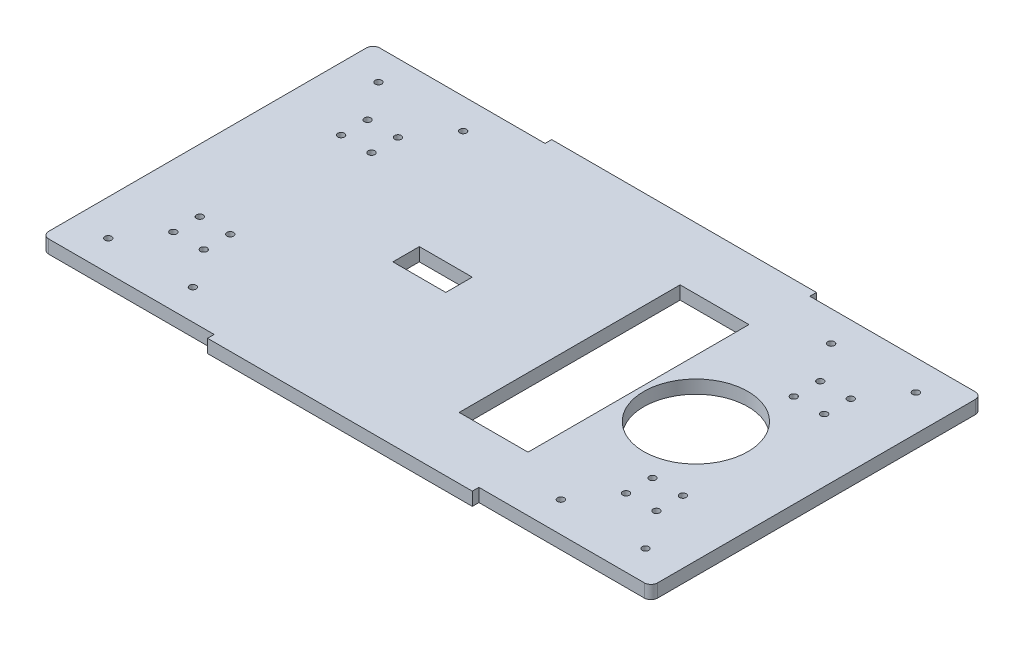
from build123d import *

# Parameters (mm, degrees)
BOSS_EXTRUDE1_DEPTH     = 6.35
SKETCH2_W               = 25.4
SKETCH2_H               = 12.7
CUT_EXTRUDE1_DEPTH      = 186.567817792
SKETCH6_W               = 203.2
SKETCH6_H               = 34.925
CUT_EXTRUDE3_DEPTH      = 186.567817792
SKETCH9_W               = 127
SKETCH9_H               = 3.175
BOSS_EXTRUDE3_DEPTH     = 6.35
SKETCH12_R              = 1.5875
CUT_EXTRUDE5_DEPTH      = 168.885161643
MIRROR2_COPY_1_SKETCH_R = 1.5875
MIRROR2_COPY_1_DEPTH    = 168.885161643
SKETCH13_R              = 25
CUT_EXTRUDE6_DEPTH      = 168.885161643
SKETCH15_W              = 33.02
SKETCH15_H              = 106
CUT_EXTRUDE7_DEPTH      = 168.885161643


with BuildPart() as part:
    # Sketch1 → Boss-Extrude1 (new body)
    with BuildSketch(Plane.XZ):
        with BuildLine():
            Line((142.875, 79.375), (66.817002043, 79.375))
            ThreePointArc((66.817002043, 79.375), (64.571938013, 80.30493597), (63.642002043, 82.55))
            Line((63.642002043, 82.55), (63.642002043, 111.125))
            ThreePointArc((63.642002043, 111.125), (62.712066074, 113.37006403), (60.467002043, 114.3))
            Line((60.467002043, 114.3), (-60.467002043, 114.3))
            ThreePointArc((-60.467002043, 114.3), (-62.712066074, 113.37006403), (-63.642002043, 111.125))
            Line((-63.642002043, 111.125), (-63.642002043, 82.55))
            ThreePointArc((-63.642002043, 82.55), (-64.571938013, 80.30493597), (-66.817002043, 79.375))
            Line((-66.817002043, 79.375), (-142.875, 79.375))
            ThreePointArc((-142.875, 79.375), (-145.12006403, 78.44506403), (-146.05, 76.2))
            Line((-146.05, 76.2), (-146.05, -76.2))
            ThreePointArc((-146.05, -76.2), (-145.12006403, -78.44506403), (-142.875, -79.375))
            Line((-142.875, -79.375), (-66.817002043, -79.375))
            ThreePointArc((-66.817002043, -79.375), (-64.571938013, -80.30493597), (-63.642002043, -82.55))
            Line((-63.642002043, -82.55), (-63.642002043, -111.125))
            ThreePointArc((-63.642002043, -111.125), (-62.712066074, -113.37006403), (-60.467002043, -114.3))
            Line((-60.467002043, -114.3), (60.467002043, -114.3))
            ThreePointArc((60.467002043, -114.3), (62.712066074, -113.37006403), (63.642002043, -111.125))
            Line((63.642002043, -111.125), (63.642002043, -82.55))
            ThreePointArc((63.642002043, -82.55), (64.571938013, -80.30493597), (66.817002043, -79.375))
            Line((66.817002043, -79.375), (142.875, -79.375))
            ThreePointArc((142.875, -79.375), (145.12006403, -78.44506403), (146.05, -76.2))
            Line((146.05, -76.2), (146.05, 76.2))
            ThreePointArc((146.05, 76.2), (145.12006403, 78.44506403), (142.875, 79.375))
        make_face()
    extrude(amount=-BOSS_EXTRUDE1_DEPTH)

    # Sketch2 → Cut-Extrude1 (cut, through all)
    with BuildSketch(Plane(origin=(0, 6.35, 0), x_dir=(1, 0, 0), z_dir=(0, 1, 0))):
        with Locations((-38.1, 0)):
            Rectangle(SKETCH2_W, SKETCH2_H)
    extrude(amount=-CUT_EXTRUDE1_DEPTH, mode=Mode.SUBTRACT)

    # Sketch6 → Cut-Extrude3 (cut, through all)
    with BuildSketch(Plane.XZ):
        with Locations((0, 96.8375)):
            Rectangle(SKETCH6_W, SKETCH6_H)
        with Locations((0, -96.8375)):
            Rectangle(SKETCH6_W, SKETCH6_H)
    extrude(amount=-CUT_EXTRUDE3_DEPTH, mode=Mode.SUBTRACT)

    # Sketch9 → Boss-Extrude3 (add)
    with BuildSketch(Plane(origin=(0, 6.35, 0), x_dir=(1, 0, 0), z_dir=(0, 1, 0))):
        with Locations((0, 80.9625)):
            Rectangle(SKETCH9_W, SKETCH9_H)
        with Locations((0, -80.9625)):
            Rectangle(SKETCH9_W, SKETCH9_H)
    extrude(amount=-BOSS_EXTRUDE3_DEPTH)

    # Sketch12 → Cut-Extrude5 (cut, symmetric)
    with BuildSketch(Plane.XZ):
        with Locations(Location((-128.905, 64.825, 0), (0, 0, 270))):
            Circle(SKETCH12_R)
        with Locations(Location((-88.265, 64.825, 0), (0, 0, 270))):
            Circle(SKETCH12_R)
        with Locations(Location((-101.289228739, 46.585, 0), (0, 0, 270))):
            Circle(SKETCH12_R)
        with Locations(Location((-101.289228739, 33.885, 0), (0, 0, 270))):
            Circle(SKETCH12_R)
        with Locations(Location((-115.880769, 33.885, 0), (0, 0, 270))):
            Circle(SKETCH12_R)
        with Locations(Location((-115.880769, 46.585, 0), (0, 0, 270))):
            Circle(SKETCH12_R)
    cut_extrude5 = extrude(amount=CUT_EXTRUDE5_DEPTH, both=True, mode=Mode.SUBTRACT)

    # Mirror1: Cut-Extrude5 across plane
    add(cut_extrude5.mirror(Plane(origin=(0, 0, 0), x_dir=(0, 0, 1), z_dir=(1, 0, 0))), mode=Mode.SUBTRACT)

    # Mirror2: Cut-Extrude5 across plane
    add(cut_extrude5.mirror(Plane(origin=(0, 0, 0), x_dir=(1, 0, 0), z_dir=(0, 0, -1))), mode=Mode.SUBTRACT)

    # Mirror2 copy 1 sketch → Mirror2 copy 1 (cut, symmetric)
    with BuildSketch(Plane(origin=(0, 0, 0), x_dir=(-1, 0, 0), z_dir=(0, -1, 0))):
        with Locations(Location((-128.905, 64.825, 0), (0, 0, 270))):
            Circle(MIRROR2_COPY_1_SKETCH_R)
        with Locations(Location((-88.265, 64.825, 0), (0, 0, 270))):
            Circle(MIRROR2_COPY_1_SKETCH_R)
        with Locations(Location((-101.289228739, 46.585, 0), (0, 0, 270))):
            Circle(MIRROR2_COPY_1_SKETCH_R)
        with Locations(Location((-101.289228739, 33.885, 0), (0, 0, 270))):
            Circle(MIRROR2_COPY_1_SKETCH_R)
        with Locations(Location((-115.880769, 33.885, 0), (0, 0, 270))):
            Circle(MIRROR2_COPY_1_SKETCH_R)
        with Locations(Location((-115.880769, 46.585, 0), (0, 0, 270))):
            Circle(MIRROR2_COPY_1_SKETCH_R)
    extrude(amount=MIRROR2_COPY_1_DEPTH, both=True, mode=Mode.SUBTRACT)

    # Sketch13 → Cut-Extrude6 (cut, through all)
    with BuildSketch(Plane(origin=(0, 6.35, 0), x_dir=(1, 0, 0), z_dir=(0, 1, 0))):
        with Locations(Location((88.21149281, 0, 0), (0, 0, 270))):
            Circle(SKETCH13_R)
    extrude(amount=-CUT_EXTRUDE6_DEPTH, mode=Mode.SUBTRACT)

    # Sketch15 → Cut-Extrude7 (cut, through all)
    with BuildSketch(Plane(origin=(0, 6.35, 0), x_dir=(1, 0, 0), z_dir=(0, 1, 0))):
        with Locations((44.163037407, 0)):
            Rectangle(SKETCH15_W, SKETCH15_H)
    extrude(amount=-CUT_EXTRUDE7_DEPTH, mode=Mode.SUBTRACT)


solid = part.part
